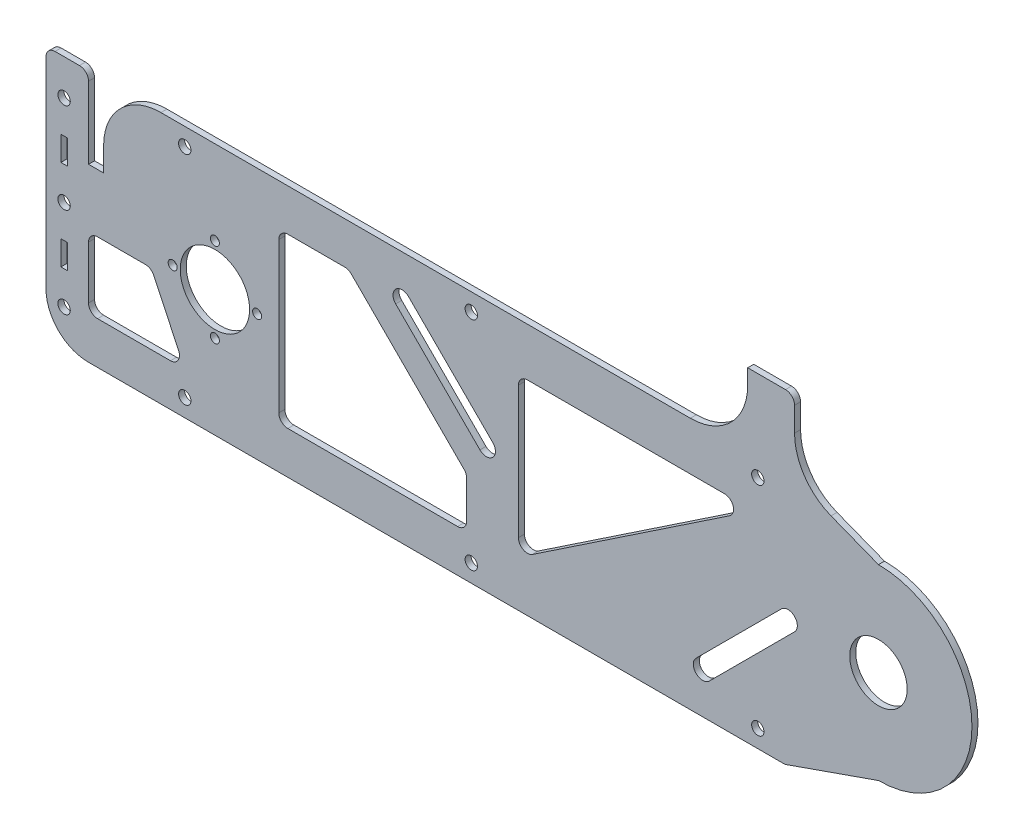
from build123d import *

# Parameters (mm, degrees)
SKETCH_1_R      = 2.05
SKETCH_1_R_2    = 11.5
SKETCH_1_R_3    = 1.5
SKETCH_1_R_4    = 9.525
SKETCH_1_W      = 2.1
SKETCH_1_H      = 8.1
EXTRUDE_1_DEPTH = 2
FILLET_2_R      = 3
FILLET_3_R      = 19
FILLET_4_R      = 14
FILLET_5_R      = 3


with BuildPart() as part:
    # 草图1 → 凸台-拉伸1 (new body)
    with BuildSketch(Plane.XY):
        with BuildLine():
            Line((-4.357142857, -0.045714286), (-4.357142857, 41.804285714))
            Line((-4.357142857, 41.804285714), (9.742857143, 41.804285714))
            Line((9.742857143, 41.804285714), (9.742857143, 14.954285714))
            Line((9.742857143, 14.954285714), (14.742857143, 14.954285714))
            Line((14.742857143, 14.954285714), (14.742857143, 41.804285714))
            Line((14.742857143, 41.804285714), (228.285977906, 41.804285714))
            Line((228.285977906, 41.804285714), (228.285977906, 65.804285714))
            Line((228.285977906, 65.804285714), (243.821285799, 65.804285714))
            Line((243.821285799, 65.804285714), (243.821285799, 41.804285714))
            Line((243.821285799, 41.804285714), (271.642857143, 30.954285714))
            ThreePointArc((271.642857143, 30.954285714), (302.642857143, -0.045714286), (271.642857143, -31.045714286))
            Line((271.642857143, -31.045714286), (240.642857143, -41.895714286))
            Line((240.642857143, -41.895714286), (-4.357142857, -41.895714286))
            Line((-4.357142857, -41.895714286), (-4.357142857, -0.045714286))
        make_face()
        with Locations((1.642857143, 29.954285714)):
            Circle(SKETCH_1_R, mode=Mode.SUBTRACT)
        with Locations((1.642857143, -0.045714286)):
            Circle(SKETCH_1_R, mode=Mode.SUBTRACT)
        with Locations((1.642857143, -30.045714286)):
            Circle(SKETCH_1_R, mode=Mode.SUBTRACT)
        with Locations((51.642857143, -0.045714286)):
            Circle(SKETCH_1_R_2, mode=Mode.SUBTRACT)
        with Locations((51.642857143, -14.045714286)):
            Circle(SKETCH_1_R_3, mode=Mode.SUBTRACT)
        with Locations((37.642857143, -0.045714286)):
            Circle(SKETCH_1_R_3, mode=Mode.SUBTRACT)
        with Locations((51.642857143, 13.954285714)):
            Circle(SKETCH_1_R_3, mode=Mode.SUBTRACT)
        with Locations((65.642857143, -0.045714286)):
            Circle(SKETCH_1_R_3, mode=Mode.SUBTRACT)
        with Locations((271.642857143, -0.045714286)):
            Circle(SKETCH_1_R_4, mode=Mode.SUBTRACT)
        with Locations((41.642857143, 35.954285714)):
            Circle(SKETCH_1_R, mode=Mode.SUBTRACT)
        with Locations((136.642857143, 35.954285714)):
            Circle(SKETCH_1_R, mode=Mode.SUBTRACT)
        with Locations((231.642857143, 35.954285714)):
            Circle(SKETCH_1_R, mode=Mode.SUBTRACT)
        with Locations((136.642857143, -36.045714286)):
            Circle(SKETCH_1_R, mode=Mode.SUBTRACT)
        with Locations((231.642857143, -36.045714286)):
            Circle(SKETCH_1_R, mode=Mode.SUBTRACT)
        with Locations((41.642857143, -36.045714286)):
            Circle(SKETCH_1_R, mode=Mode.SUBTRACT)
        with Locations((1.642857143, 14.954285714)):
            Rectangle(SKETCH_1_W, SKETCH_1_H, mode=Mode.SUBTRACT)
        with Locations((1.642857143, -15.045714286)):
            Rectangle(SKETCH_1_W, SKETCH_1_H, mode=Mode.SUBTRACT)
        with BuildLine():
            Line((139.521536799, -2.167034629), (111.571536799, 25.782965371))
            ThreePointArc((111.571536799, 25.782965371), (111.571536799, 30.025606058), (115.814177486, 30.025606058))
            Line((115.814177486, 30.025606058), (143.764177486, 2.075606058))
            ThreePointArc((143.764177486, 2.075606058), (143.764177486, -2.167034629), (139.521536799, -2.167034629))
        make_face(mode=Mode.SUBTRACT)
        Polygon((95.965816792, 27.904285714), (135.122522002, -11.252419496), (135.122522002, -27.867735073), (72.8281641, -27.867735073), (72.8281641, 27.904285714), align=None, mode=Mode.SUBTRACT)
        Polygon((9.742857143, -4.38924766), (30.529534128, -4.38924766), (41.642857143, -27.867735073), (9.742857143, -27.867735073), align=None, mode=Mode.SUBTRACT)
        Polygon((152.259089612, -26.603879462), (230.464406562, 25.782965371), (152.259089612, 25.782965371), align=None, mode=Mode.SUBTRACT)
        with BuildLine():
            Line((243.833851294, -2.236708437), (215.549580047, -30.520979685))
            ThreePointArc((215.549580047, -30.520979685), (211.167591744, -30.520979685), (211.167591744, -26.138991382))
            Line((211.167591744, -26.138991382), (239.451862991, 2.145279866))
            ThreePointArc((239.451862991, 2.145279866), (243.833851294, 2.145279866), (243.833851294, -2.236708437))
        make_face(mode=Mode.SUBTRACT)
    extrude(amount=EXTRUDE_1_DEPTH)

    # 圆角2
    fillet_2_edges = [part.edges().sort_by_distance(p)[0] for p in [
        (41.642857143, -27.867735073, 1),
        (30.529534128, -4.38924766, 1),
        (9.742857143, -4.38924766, 1),
        (9.742857143, -27.867735073, 1),
        (72.8281641, -27.867735073, 1),
        (135.122522002, -27.867735073, 1),
        (135.122522002, -11.252419496, 1),
        (95.965816792, 27.904285714, 1),
        (72.8281641, 27.904285714, 1),
        (152.259089612, -26.603879462, 1),
        (230.464406562, 25.782965371, 1),
        (152.259089612, 25.782965371, 1),
        (243.821285799, 65.804285714, 1),
    ]]
    fillet(fillet_2_edges, radius=FILLET_2_R)

    # 圆角3
    fillet_3_edges = [part.edges().sort_by_distance(p)[0] for p in [
        (14.742857143, 41.804285714, 1),
        (228.285977906, 41.804285714, 1),
        (243.821285799, 41.804285714, 1),
    ]]
    fillet(fillet_3_edges, radius=FILLET_3_R)

    # 圆角4
    fillet_4_edges = [part.edges().sort_by_distance(p)[0] for p in [
        (-4.357142857, -41.895714286, 1),
    ]]
    fillet(fillet_4_edges, radius=FILLET_4_R)

    # 圆角5
    fillet_5_edges = [part.edges().sort_by_distance(p)[0] for p in [
        (-4.357142857, 41.804285714, 1),
        (9.742857143, 41.804285714, 1),
    ]]
    fillet(fillet_5_edges, radius=FILLET_5_R)


solid = part.part
